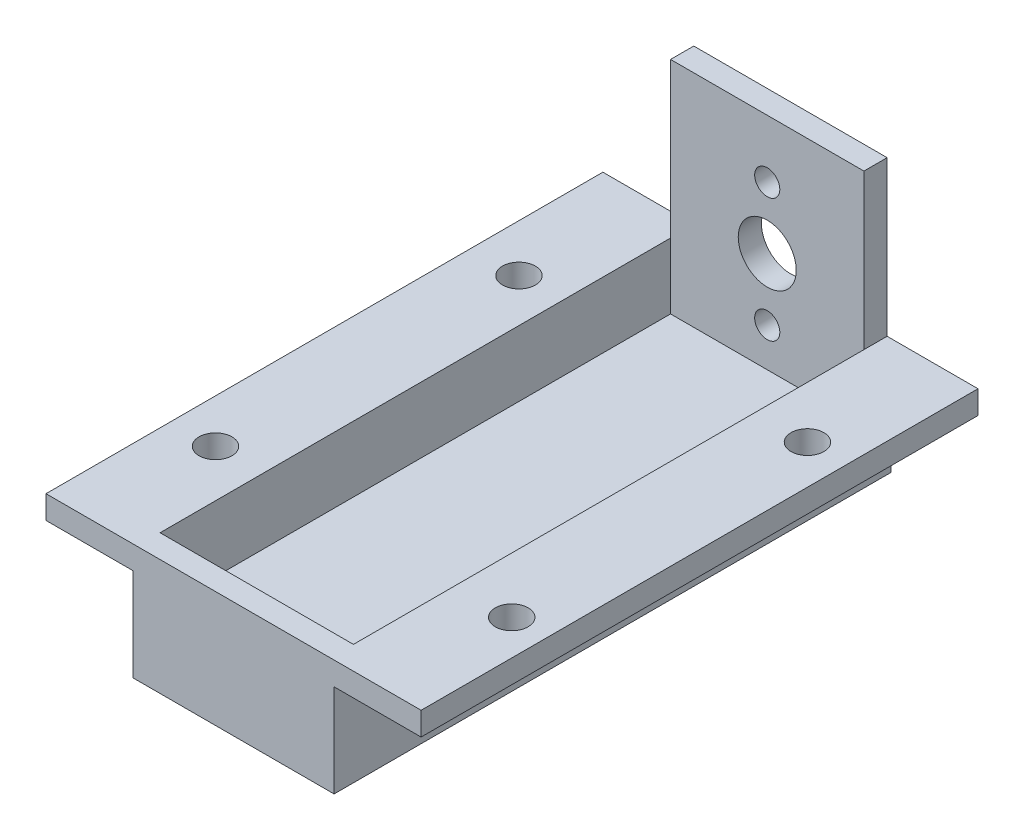
from build123d import *

# Parameters (mm, degrees)
SALIENTE_EXTRUIR1_DEPTH = 72
CROQUIS4_W              = 25
CROQUIS4_H              = 20
CORTAR_EXTRUIR1_DEPTH   = 69
CROQUIS5_W              = 25
CROQUIS5_H              = 66
CORTAR_EXTRUIR2_DEPTH   = 8.5
CROQUIS7_R              = 2.125
CORTAR_EXTRUIR3_DEPTH   = 8.5
CROQUIS8_R              = 3.75
CROQUIS8_R_2            = 1.625
CORTAR_EXTRUIR4_DEPTH   = 3


with BuildPart() as part:
    # Croquis1 → Saliente-Extruir1 (new body)
    with BuildSketch(Plane.XY):
        Polygon((12.5, 0), (-12.5, 0), (-12.5, -20), (-24.25, -20), (-24.25, -23), (-13, -23), (-13, -35), (13, -35), (13, -23), (24.25, -23), (24.25, -20), (12.5, -20), align=None)
    extrude(amount=SALIENTE_EXTRUIR1_DEPTH)

    # Croquis4 → Cortar-Extruir1 (cut)
    with BuildSketch(Plane.XY.offset(72)):
        with Locations((0, -10)):
            Rectangle(CROQUIS4_W, CROQUIS4_H)
    extrude(amount=-CORTAR_EXTRUIR1_DEPTH, mode=Mode.SUBTRACT)

    # Croquis5 → Cortar-Extruir2 (cut)
    with BuildSketch(Plane(origin=(0, -20, 0), x_dir=(1, 0, 0), z_dir=(0, 1, 0))):
        with Locations((0, -36)):
            Rectangle(CROQUIS5_W, CROQUIS5_H)
    extrude(amount=-CORTAR_EXTRUIR2_DEPTH, mode=Mode.SUBTRACT)

    # Croquis7 → Cortar-Extruir3 (cut)
    with BuildSketch(Plane(origin=(0, -20, 0), x_dir=(1, 0, 0), z_dir=(0, 1, 0))):
        with Locations(Location((-18.1, -17, 0), (0, 0, 180))):
            Circle(CROQUIS7_R)
        with Locations(Location((-18.6, -55.737923395, 0), (0, 0, 180))):
            Circle(CROQUIS7_R)
        with Locations(Location((19.2, -17, 0), (0, 0, 180))):
            Circle(CROQUIS7_R)
        with Locations(Location((19.7, -55.737923395, 0), (0, 0, 180))):
            Circle(CROQUIS7_R)
    extrude(amount=-CORTAR_EXTRUIR3_DEPTH, mode=Mode.SUBTRACT)

    # Croquis8 → Cortar-Extruir4 (cut)
    with BuildSketch(Plane(origin=(0, 0, 0), x_dir=(-1, 0, 0), z_dir=(0, 0, -1))):
        with Locations((0, -15.5)):
            Circle(CROQUIS8_R)
        with Locations((0, -23.5)):
            Circle(CROQUIS8_R_2)
        with Locations((0, -7.5)):
            Circle(CROQUIS8_R_2)
    extrude(amount=-CORTAR_EXTRUIR4_DEPTH, mode=Mode.SUBTRACT)


solid = part.part
